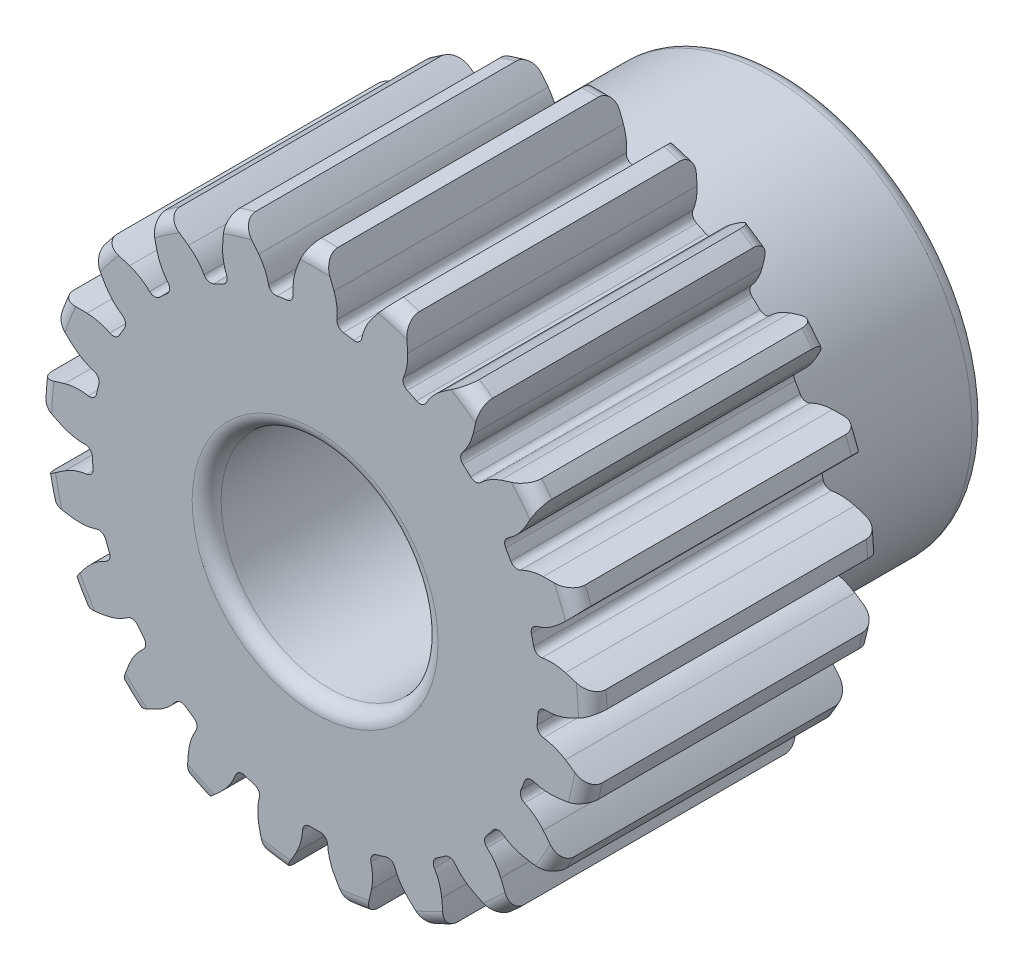
from build123d import *

# Parameters (mm, degrees)
CUT_EXTRUDE1_DEPTH = 54.687212901
CIRPATTERN1_COUNT  = 21


with BuildPart() as part:
    # Sketch3 → Revolve1 (revolve)
    with BuildSketch(Plane(origin=(0, 0, 0), x_dir=(0, 0, -1), z_dir=(1, 0, 0)), mode=Mode.PRIVATE) as revolve1_sk:
        with BuildLine():
            Line((19.304, 9.525), (-19.304, 9.525))
            ThreePointArc((-19.304, 9.525), (-20.202025612, 9.896974388), (-20.574, 10.795))
            Line((-20.574, 10.795), (-20.574, 23.114))
            ThreePointArc((-20.574, 23.114), (-20.202025612, 24.012025612), (-19.304, 24.384))
            Line((-19.304, 24.384), (3.556, 24.384))
            ThreePointArc((3.556, 24.384), (4.454025612, 24.012025612), (4.826, 23.114))
            Line((4.826, 23.114), (4.826, 19.05))
            ThreePointArc((4.826, 19.05), (5.197974388, 18.151974388), (6.096, 17.78))
            Line((6.096, 17.78), (19.304, 17.78))
            ThreePointArc((19.304, 17.78), (20.202025612, 17.408025612), (20.574, 16.51))
            Line((20.574, 16.51), (20.574, 10.795))
            ThreePointArc((20.574, 10.795), (20.202025612, 9.896974388), (19.304, 9.525))
        make_face()
    revolve(revolve1_sk.sketch.rotate(Axis((0, 0, -20.574), (0, 0, 1)), 90), axis=Axis((0, 0, -20.574), (0, 0, 1)))

    # Sketch4 → Cut-Extrude1 (cut, symmetric)
    with BuildSketch(Plane.XY.offset(20.574)):
        with BuildLine():
            ThreePointArc((6.495032656, 23.503063775), (3.634246618, 24.111650867), (0.721173084, 24.373333079))
            ThreePointArc((0.721173084, 24.373333079), (1.220268128, 23.280524575), (1.660880207, 22.162854102))
            ThreePointArc((1.660880207, 22.162854102), (1.906018266, 21.152276402), (1.922442886, 20.112521532))
            ThreePointArc((1.922442886, 20.112521532), (2.058572487, 19.655591584), (2.474313799, 19.42219191))
            ThreePointArc((2.474313799, 19.42219191), (2.91812337, 19.360483552), (3.360404585, 19.288635213))
            ThreePointArc((3.360404585, 19.288635213), (3.826471438, 19.389123692), (4.09123565, 19.78562862))
            ThreePointArc((4.09123565, 19.78562862), (4.413403697, 20.774348856), (4.945523967, 21.667773713))
            ThreePointArc((4.945523967, 21.667773713), (5.696000043, 22.605916533), (6.495032656, 23.503063775))
        make_face()
    cut_extrude1 = extrude(amount=CUT_EXTRUDE1_DEPTH, both=True, mode=Mode.SUBTRACT)

    # CirPattern1: Cut-Extrude1 ×21 about axis
    cirpattern1_axis = Axis((0, 0, 0), (0, 0, 1))
    for i in range(1, CIRPATTERN1_COUNT):
        add(cut_extrude1.rotate(cirpattern1_axis, i * 360 / CIRPATTERN1_COUNT), mode=Mode.SUBTRACT)


solid = part.part
